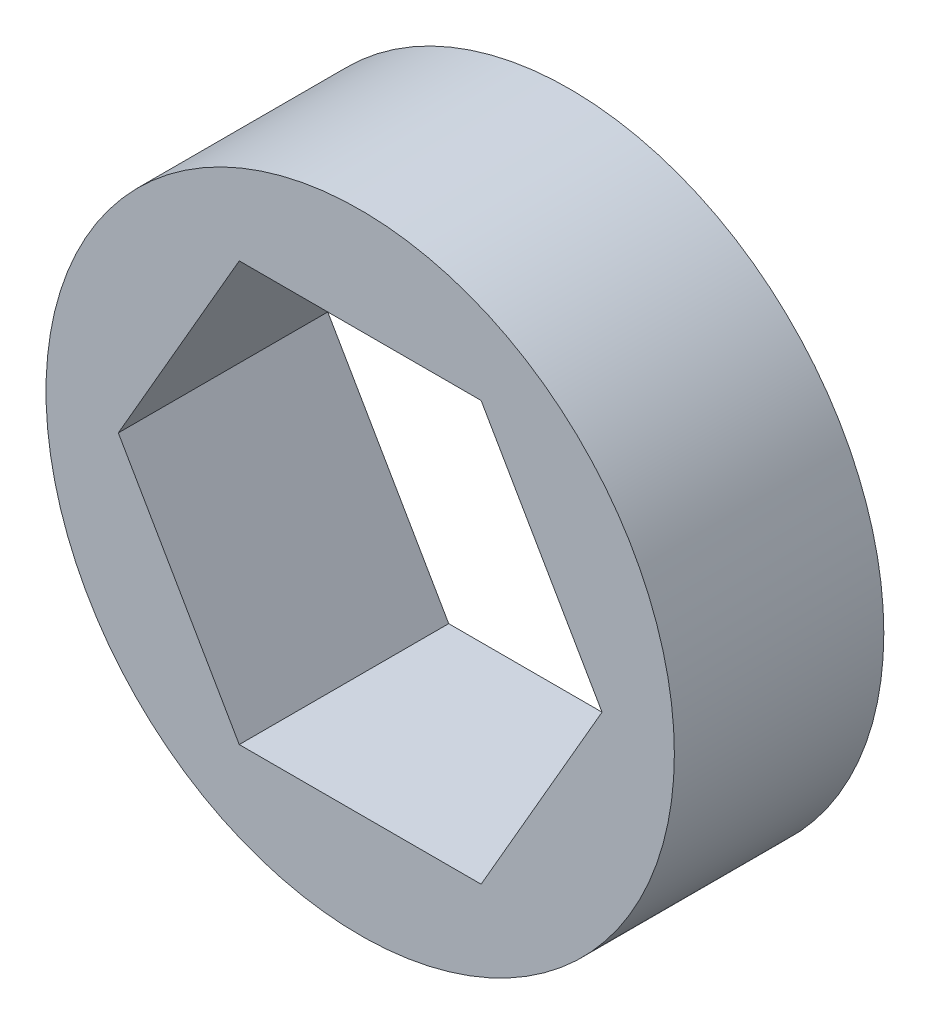
from build123d import *

# Parameters (mm, degrees)
SKETCH1_R           = 9.525
BOSS_EXTRUDE1_DEPTH = 6.35


with BuildPart() as part:
    # Sketch1 → Boss-Extrude1 (new body)
    with BuildSketch(Plane.XY):
        Circle(SKETCH1_R)
        Polygon((-3.666174209, 6.35), (-7.332348419, 0), (-3.666174209, -6.35), (3.666174209, -6.35), (7.332348419, 0), (3.666174209, 6.35), align=None, mode=Mode.SUBTRACT)
    extrude(amount=BOSS_EXTRUDE1_DEPTH)


solid = part.part
